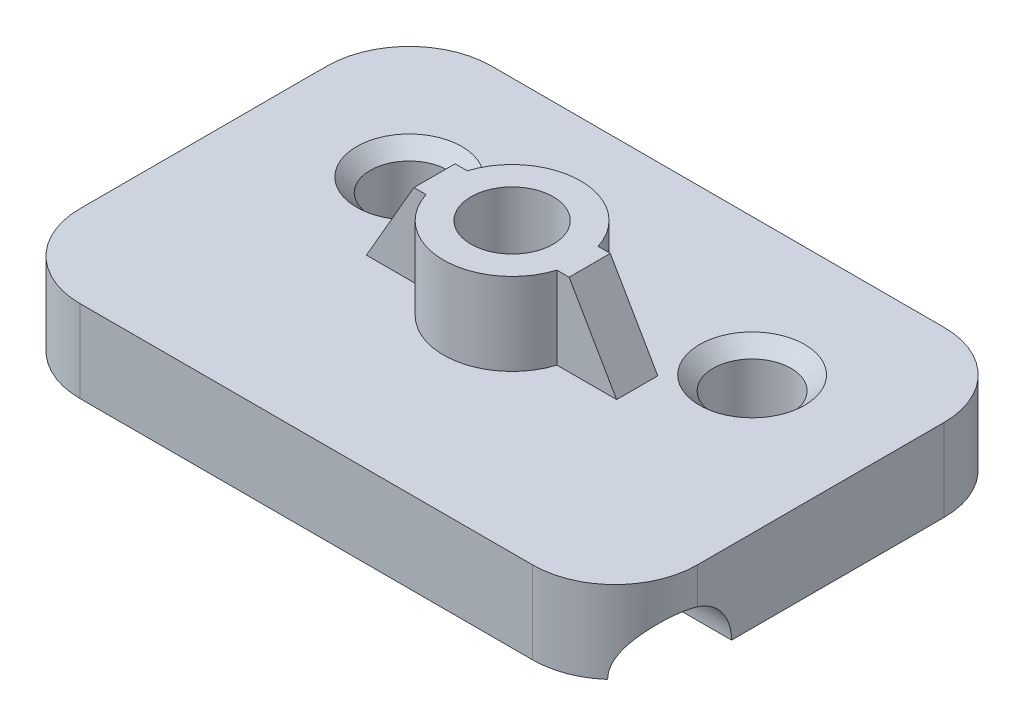
from build123d import *

# Parameters (mm, degrees)
IZIM1_R                           = 3
Y_KSEKLIK_EKSTR_ZYON1_DEPTH       = 6
IZIM2_R                           = 5
IZIM2_R_2                         = 3
Y_KSEKLIK_EKSTR_ZYON2_DEPTH       = 6
Y_KSEKLIK_EKSTR_ZYON3_DEPTH       = 1.5
KES_EKSTR_ZYON1_REACH             = 31.585
IZIM5_R                           = 3.5
KES_EKSTR_ZYON1_DIRECTION_2_REACH = 31.585
IZIM6_R                           = 2.838174874
KES_EKSTR_ZYON2_DEPTH             = 44
PAH1_SIZE                         = 1


with BuildPart() as part:
    # Çizim1 → Yükseklik-Ekstrüzyon1 (new body)
    with BuildSketch(Plane(origin=(0, 0, 0), x_dir=(1, 0, 0), z_dir=(0, 1, 0))):
        with BuildLine():
            Line((-16.5, 15), (16.5, 15))
            ThreePointArc((16.5, 15), (20.742640687, 13.242640687), (22.5, 9))
            Line((22.5, 9), (22.5, -9))
            ThreePointArc((22.5, -9), (20.742640687, -13.242640687), (16.5, -15))
            Line((16.5, -15), (-16.5, -15))
            ThreePointArc((-16.5, -15), (-20.742640687, -13.242640687), (-22.5, -9))
            Line((-22.5, -9), (-22.5, 9))
            ThreePointArc((-22.5, 9), (-20.742640687, 13.242640687), (-16.5, 15))
        make_face()
        with Locations(Location((0, 0, 0), (0, 0, 270))):
            Circle(IZIM1_R, mode=Mode.SUBTRACT)
    extrude(amount=Y_KSEKLIK_EKSTR_ZYON1_DEPTH)

    # Çizim2 → Yükseklik-Ekstrüzyon2 (add)
    with BuildSketch(Plane(origin=(0, 6, 0), x_dir=(1, 0, 0), z_dir=(0, 1, 0))):
        with Locations(Location((0, 0, 0), (0, 0, 270))):
            Circle(IZIM2_R)
        with Locations(Location((0, 0, 0), (0, 0, 270))):
            Circle(IZIM2_R_2, mode=Mode.SUBTRACT)
    extrude(amount=Y_KSEKLIK_EKSTR_ZYON2_DEPTH)

    # Çizim4 → Yükseklik-Ekstrüzyon3 (add, symmetric)
    with BuildSketch(Plane.XY):
        Polygon((-5.65775064, 12), (-3.798545346, 12), (-3.798545346, 6), (-9.121852255, 6), align=None)
        Polygon((3.798545346, 12), (3.798545346, 6), (9.121852255, 6), (5.65775064, 12), align=None)
    extrude(amount=Y_KSEKLIK_EKSTR_ZYON3_DEPTH, both=True)

    # Kes-Ekstrüzyon1: up to this face of the body (flat: up to its plane)
    kes_ekstr_zyon1_end = Plane(part.part.faces().sort_by_distance((-22.5, 3, 0))[0])
    # Çizim5 → Kes-Ekstrüzyon1 (cut, up to the picked face)
    with BuildSketch(Plane(origin=(0, 0, 0), x_dir=(0, 0, -1), z_dir=(1, 0, 0)), mode=Mode.PRIVATE) as kes_ekstr_zyon1_sk1:
        with Locations((-10, 0)):
            Circle(IZIM5_R)
    kes_ekstr_zyon1_tool1 = split(extrude(kes_ekstr_zyon1_sk1.sketch, amount=-KES_EKSTR_ZYON1_REACH, mode=Mode.PRIVATE), bisect_by=kes_ekstr_zyon1_end, keep=Keep.BOTH, mode=Mode.PRIVATE)
    add(kes_ekstr_zyon1_tool1.solids().sort_by(Axis((0, 0, 10), (-1, 0, 0)))[0], mode=Mode.SUBTRACT)

    # Kes-Ekstrüzyon1 direction 2: up to this face of the body (flat: up to its plane)
    kes_ekstr_zyon1_direction_2_end = Plane(part.part.faces().sort_by_distance((22.5, 3, 0))[0])
    # Çizim5 → Kes-Ekstrüzyon1 direction 2 (cut, up to the picked face)
    with BuildSketch(Plane(origin=(0, 0, 0), x_dir=(0, 0, -1), z_dir=(1, 0, 0)), mode=Mode.PRIVATE) as kes_ekstr_zyon1_direction_2_sk1:
        with Locations((-10, 0)):
            Circle(IZIM5_R)
    kes_ekstr_zyon1_direction_2_tool1 = split(extrude(kes_ekstr_zyon1_direction_2_sk1.sketch, amount=KES_EKSTR_ZYON1_DIRECTION_2_REACH, mode=Mode.PRIVATE), bisect_by=kes_ekstr_zyon1_direction_2_end, keep=Keep.BOTH, mode=Mode.PRIVATE)
    add(kes_ekstr_zyon1_direction_2_tool1.solids().sort_by(Axis((0, 0, 10), (1, 0, 0)))[0], mode=Mode.SUBTRACT)

    # Çizim6 → Kes-Ekstrüzyon2 (cut)
    with BuildSketch(Plane.XZ):
        with Locations(Location((-12.5, -5, 0), (0, 0, 270))):
            Circle(IZIM6_R)
        with Locations(Location((12.5, -5, 0), (0, 0, 270))):
            Circle(IZIM6_R)
    extrude(amount=-KES_EKSTR_ZYON2_DEPTH, mode=Mode.SUBTRACT)

    # Pah1
    pah1_edges = [part.edges().sort_by_distance(p)[0] for p in [
        (-12.5, 6, -2.161825126),
        (-12.5, 0, -2.161825126),
        (12.5, 6, -2.161825126),
        (12.5, 0, -2.161825126),
    ]]
    chamfer(pah1_edges, length=PAH1_SIZE)


solid = part.part
